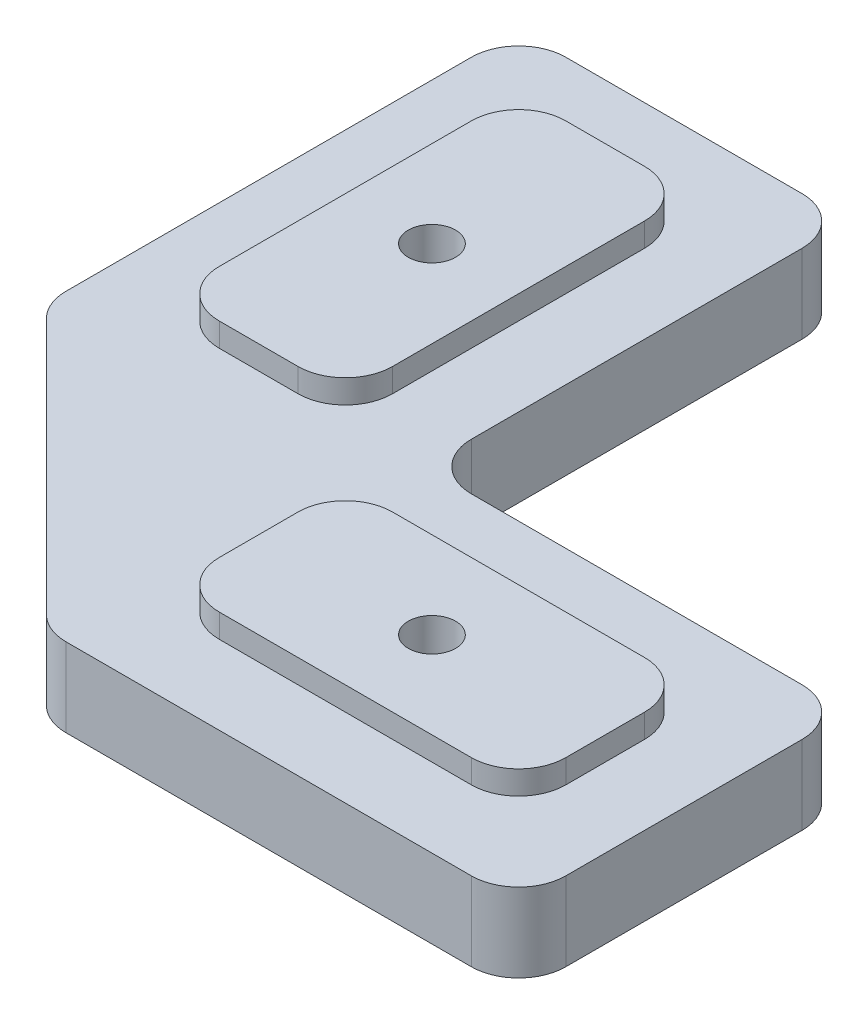
from build123d import *

# Parameters (mm, degrees)
SALIENTE_EXTRUIR1_DEPTH   = 1.5
SALIENTE_EXTRUIR1_2_DEPTH = 1.5
SALIENTE_EXTRUIR2_DEPTH   = 5
CROQUIS3_R                = 1.5
CORTAR_EXTRUIR1_DEPTH     = 45
CORTAR_EXTRUIR2_DEPTH     = 2.3
CROQUIS5_R                = 1.5
CORTAR_EXTRUIR3_DEPTH     = 42.3
CORTAR_EXTRUIR4_DEPTH     = 2.3


with BuildPart() as part:
    # Croquis1 → Saliente-Extruir1 (new body)
    with BuildSketch(Plane(origin=(0, 0, 0), x_dir=(1, 0, 0), z_dir=(0, 1, 0))):
        with BuildLine():
            Line((3, 38), (8, 38))
            ThreePointArc((8, 38), (10.121320344, 37.121320344), (11, 35))
            Line((11, 35), (11, 19))
            ThreePointArc((11, 19), (10.121320344, 16.878679656), (8, 16))
            Line((8, 16), (3, 16))
            ThreePointArc((3, 16), (0.878679656, 16.878679656), (0, 19))
            Line((0, 19), (0, 35))
            ThreePointArc((0, 35), (0.878679656, 37.121320344), (3, 38))
        make_face()
    extrude(amount=SALIENTE_EXTRUIR1_DEPTH)



with BuildPart() as body_2:
    # Croquis1 → Saliente-Extruir1 2 (new body)
    with BuildSketch(Plane(origin=(0, 0, 0), x_dir=(1, 0, 0), z_dir=(0, 1, 0))):
        with BuildLine():
            Line((19, 11), (35, 11))
            ThreePointArc((35, 11), (37.121320344, 10.121320344), (38, 8))
            Line((38, 8), (38, 3))
            ThreePointArc((38, 3), (37.121320344, 0.878679656), (35, 0))
            Line((35, 0), (19, 0))
            ThreePointArc((19, 0), (16.878679656, 0.878679656), (16, 3))
            Line((16, 3), (16, 8))
            ThreePointArc((16, 8), (16.878679656, 10.121320344), (19, 11))
        make_face()
    extrude(amount=SALIENTE_EXTRUIR1_2_DEPTH)


with BuildPart() as part_1:
    add(part.part)

    add(body_2.part)  # Saliente-Extruir2 merges body 2
    # Croquis2 → Saliente-Extruir2 (add)
    with BuildSketch(Plane(origin=(0, 0, 0), x_dir=(1, 0, 0), z_dir=(0, 1, 0))):
        with BuildLine():
            Line((-2, 43), (13, 43))
            ThreePointArc((13, 43), (15.121320344, 42.121320344), (16, 40))
            Line((16, 40), (16, 19))
            ThreePointArc((16, 19), (16.878679656, 16.878679656), (19, 16))
            Line((19, 16), (40, 16))
            ThreePointArc((40, 16), (42.121320344, 15.121320344), (43, 13))
            Line((43, 13), (43, -2))
            ThreePointArc((43, -2), (42.121320344, -4.121320344), (40, -5))
            Line((40, -5), (14.269081713, -5))
            ThreePointArc((14.269081713, -5), (13.121031415, -4.771638598), (12.147761369, -4.121320344))
            Line((12.147761369, -4.121320344), (-4.121320344, 12.147761369))
            ThreePointArc((-4.121320344, 12.147761369), (-4.771638598, 13.121031415), (-5, 14.269081713))
            Line((-5, 14.269081713), (-5, 40))
            ThreePointArc((-5, 40), (-4.121320344, 42.121320344), (-2, 43))
        make_face()
    extrude(amount=-SALIENTE_EXTRUIR2_DEPTH)

    # Croquis3 → Cortar-Extruir1 (cut)
    with BuildSketch(Plane(origin=(0, 1.5, 0), x_dir=(1, 0, 0), z_dir=(0, 1, 0))):
        with Locations((5.5, 27)):
            Circle(CROQUIS3_R)
    extrude(amount=-CORTAR_EXTRUIR1_DEPTH, mode=Mode.SUBTRACT)

    # Croquis4 → Cortar-Extruir2 (cut)
    with BuildSketch(Plane.XZ.offset(5)):
        Polygon((2.669346369, -28.789059349), (5.634044029, -30.345947628), (8.464697661, -28.556888279), (8.330653631, -25.210940651), (5.365955971, -23.654052372), (2.535302339, -25.443111721), align=None)
    extrude(amount=-CORTAR_EXTRUIR2_DEPTH, mode=Mode.SUBTRACT)

    # Croquis5 → Cortar-Extruir3 (cut)
    with BuildSketch(Plane(origin=(0, 1.5, 0), x_dir=(1, 0, 0), z_dir=(0, 1, 0))):
        with Locations((27, 5.5)):
            Circle(CROQUIS5_R)
    extrude(amount=-CORTAR_EXTRUIR3_DEPTH, mode=Mode.SUBTRACT)

    # Croquis8 → Cortar-Extruir4 (cut)
    with BuildSketch(Plane.XZ.offset(5)):
        Polygon((24.250581209, -3.588448368), (23.96983833, -6.925290703), (26.719257122, -8.836842335), (29.749418791, -7.411551632), (30.03016167, -4.074709297), (27.280742878, -2.163157665), align=None)
    extrude(amount=-CORTAR_EXTRUIR4_DEPTH, mode=Mode.SUBTRACT)


solid = part_1.part
